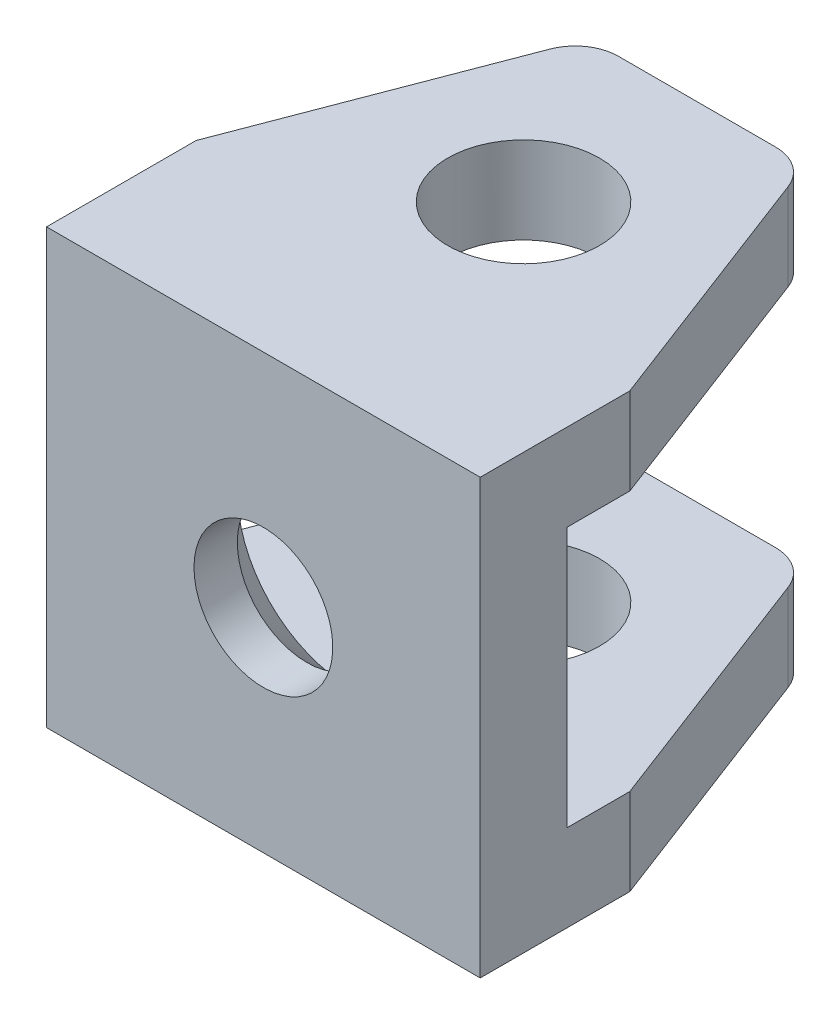
from build123d import *

# Parameters (mm, degrees)
EXTRUDE_1_DEPTH     = 10
SKETCH_2_W          = 8
SKETCH_2_H          = 6
CUT_EXTRUDE_1_DEPTH = 10
SKETCH_3_R          = 1.75
CUT_EXTRUDE_2_DEPTH = 10
FILLET_1_R          = 1
SKETCH_4_R          = 1.6
CUT_EXTRUDE_3_DEPTH = 10
CHAMFER_1_SIZE      = 1


with BuildPart() as part:
    # 草图1 → 凸台-拉伸1 (new body)
    with BuildSketch(Plane(origin=(0, 0, 0), x_dir=(1, 0, 0), z_dir=(0, 1, 0))):
        Polygon((-2.5, 5), (-5, -1.550851348), (-5, -5), (5, -5), (5, -1.550851348), (2.5, 5), align=None)
    extrude(amount=EXTRUDE_1_DEPTH)

    # 草图2 → 切除-拉伸1 (cut)
    with BuildSketch(Plane(origin=(5, 0, 0), x_dir=(0, 0, -1), z_dir=(1, 0, 0))):
        with Locations((1, 5)):
            Rectangle(SKETCH_2_W, SKETCH_2_H)
    extrude(amount=-CUT_EXTRUDE_1_DEPTH, mode=Mode.SUBTRACT)

    # 草图3 → 切除-拉伸2 (cut)
    with BuildSketch(Plane.XZ):
        with Locations(Location((0, -1, 0), (0, 0, 270))):
            Circle(SKETCH_3_R)
    extrude(amount=-CUT_EXTRUDE_2_DEPTH, mode=Mode.SUBTRACT)

    # 圆角1
    fillet_1_edges = [part.edges().sort_by_distance(p)[0] for p in [
        (-2.5, 9, -5),
        (2.5, 9, -5),
        (-2.5, 1, -5),
        (2.5, 1, -5),
    ]]
    fillet(fillet_1_edges, radius=FILLET_1_R)

    # 草图4 → 切除-拉伸3 (cut)
    with BuildSketch(Plane(origin=(0, 0, 3), x_dir=(-1, 0, 0), z_dir=(0, 0, -1))):
        with Locations((0, 4.900814168)):
            Circle(SKETCH_4_R)
    extrude(amount=-CUT_EXTRUDE_3_DEPTH, mode=Mode.SUBTRACT)

    # 倒角1
    chamfer_1_edges = [part.edges().sort_by_distance(p)[0] for p in [
        (1.6, 4.900814168, 3),
    ]]
    chamfer(chamfer_1_edges, length=CHAMFER_1_SIZE)


solid = part.part
